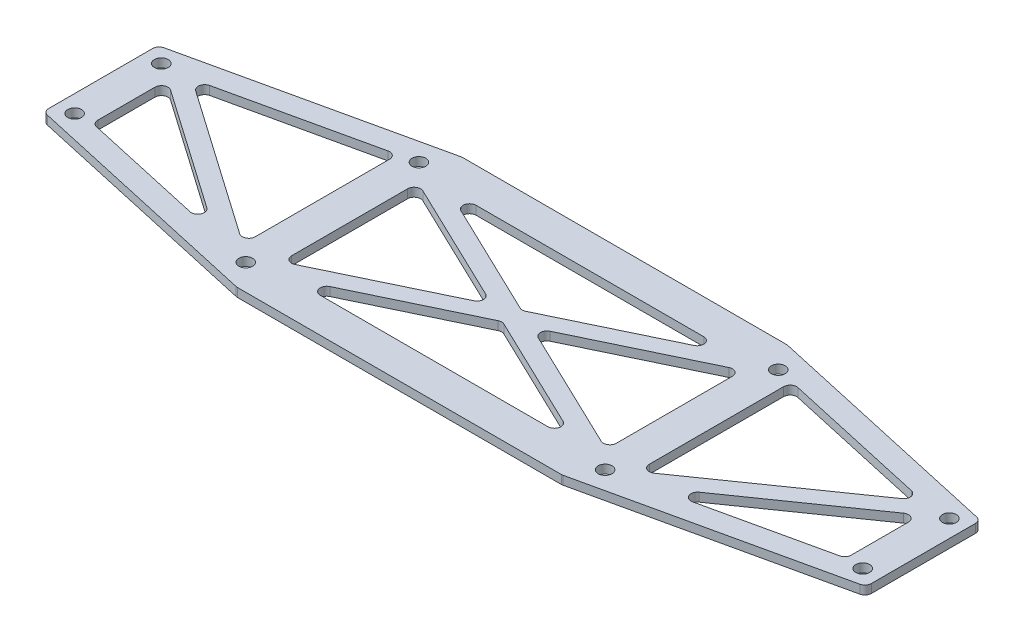
from build123d import *

# Parameters (mm, degrees)
SKETCH_1_W          = 190
SKETCH_1_H          = 52
SKETCH_1_R          = 1.6
SKETCH_1_W_2        = 75
SKETCH_1_H_2        = 36
EXTRUDE_1_DEPTH     = 2
CUT_EXTRUDE_1_DEPTH = 2
EXTRUDE_1_2_DEPTH   = 2
FILLET_1_R          = 1.5


with BuildPart() as part:
    # 草图1 → Extrude 1 (new body)
    with BuildSketch(Plane(origin=(0, 0, 0), x_dir=(1, 0, 0), z_dir=(0, 1, 0))):
        Rectangle(SKETCH_1_W, SKETCH_1_H)
        with Locations(Location((91, -10, 0), (0, 0, 270))):
            Circle(SKETCH_1_R, mode=Mode.SUBTRACT)
        with Locations(Location((91, 10, 0), (0, 0, 270))):
            Circle(SKETCH_1_R, mode=Mode.SUBTRACT)
        with Locations(Location((-91, 10, 0), (0, 0, 270))):
            Circle(SKETCH_1_R, mode=Mode.SUBTRACT)
        with Locations(Location((-91, -10, 0), (0, 0, 270))):
            Circle(SKETCH_1_R, mode=Mode.SUBTRACT)
        with Locations(Location((41.5, -20, 0), (0, 0, 270))):
            Circle(SKETCH_1_R, mode=Mode.SUBTRACT)
        with Locations(Location((-41.5, -20, 0), (0, 0, 270))):
            Circle(SKETCH_1_R, mode=Mode.SUBTRACT)
        with Locations(Location((-41.5, 20, 0), (0, 0, 270))):
            Circle(SKETCH_1_R, mode=Mode.SUBTRACT)
        with Locations(Location((41.5, 20, 0), (0, 0, 270))):
            Circle(SKETCH_1_R, mode=Mode.SUBTRACT)
        Rectangle(SKETCH_1_W_2, SKETCH_1_H_2, mode=Mode.SUBTRACT)
    extrude(amount=EXTRUDE_1_DEPTH)

    # 草图2 → 切除-拉伸1 (cut)
    with BuildSketch(Plane(origin=(0, 2, 0), x_dir=(1, 0, 0), z_dir=(0, 1, 0))):
        Polygon((95, 13.207136478), (37.560055456, 26), (95, 26), align=None)
        Polygon((37.560055456, -26), (95, -26), (95, -13.207136478), align=None)
        Polygon((-95, -26), (-95, -13.207136478), (-37.560055456, -26), align=None)
        Polygon((-95, 26), (-95, 13.207136478), (-37.560055456, 26), align=None)
        Polygon((45.5, 19.109131207), (45.5, -19.109131207), (87, -9.866367475), (87, 9.866367475), align=None)
        Polygon((-87, -9.866367475), (-87, 9.866367475), (-45.5, 19.109131207), (-45.5, -19.109131207), align=None)
    extrude(amount=-CUT_EXTRUDE_1_DEPTH, mode=Mode.SUBTRACT)

    # 草图3 → Extrude 1 2 (add)
    with BuildSketch(Plane(origin=(0, 2, 0), x_dir=(1, 0, 0), z_dir=(0, 1, 0))):
        Polygon((-44.355051898, -17.46928553), (-85.855051898, 11.506213152), (-88.144948102, 8.226521799), (-46.644948102, -20.748976883), align=None)
        Polygon((36.634537865, 19.803046115), (-38.365462135, -16.196953885), (-36.634537865, -19.803046115), (38.365462135, 16.196953885), align=None)
        Polygon((-38.365462135, 16.196953885), (36.634537865, -19.803046115), (38.365462135, -16.196953885), (-36.634537865, 19.803046115), align=None)
        Polygon((46.644948102, -20.748976883), (88.144948102, 8.226521799), (85.855051898, 11.506213152), (44.355051898, -17.46928553), align=None)
    extrude(amount=-EXTRUDE_1_2_DEPTH)

    # 圆角1
    fillet_1_edges = [part.edges().sort_by_distance(p)[0] for p in [
        (-87, 1, 9.866367475),
        (-45.5, 1, -19.109131207),
        (95, 1, -13.207136478),
        (37.560055456, 1, -26),
        (-45.5, 1, 16.669877284),
        (-87, 1, -7.427113552),
        (-50.630005448, 1, 17.966590766),
        (-84.351291466, 1, -10.456280419),
        (32.878191792, 1, 18),
        (-32.878191792, 1, 18),
        (-37.5, 1, -15.78153206),
        (-37.5, 1, 15.78153206),
        (-32.878191792, 1, -18),
        (32.878191792, 1, -18),
        (37.5, 1, 15.78153206),
        (37.5, 1, -15.78153206),
        (0, 1, -2.21846794),
        (0, 1, 2.21846794),
        (4.621808208, 1, 0),
        (-4.621808208, 1, 0),
        (45.5, 1, 16.669877284),
        (50.630005448, 1, 17.966590766),
        (87, 1, -7.427113552),
        (84.351291466, 1, -10.456280419),
        (45.5, 1, -19.109131207),
        (87, 1, 9.866367475),
        (-37.560055456, 1, -26),
        (-95, 1, -13.207136478),
        (-37.560055456, 1, 26),
        (-95, 1, 13.207136478),
        (37.560055456, 1, 26),
        (95, 1, 13.207136478),
    ]]
    fillet(fillet_1_edges, radius=FILLET_1_R)


solid = part.part
